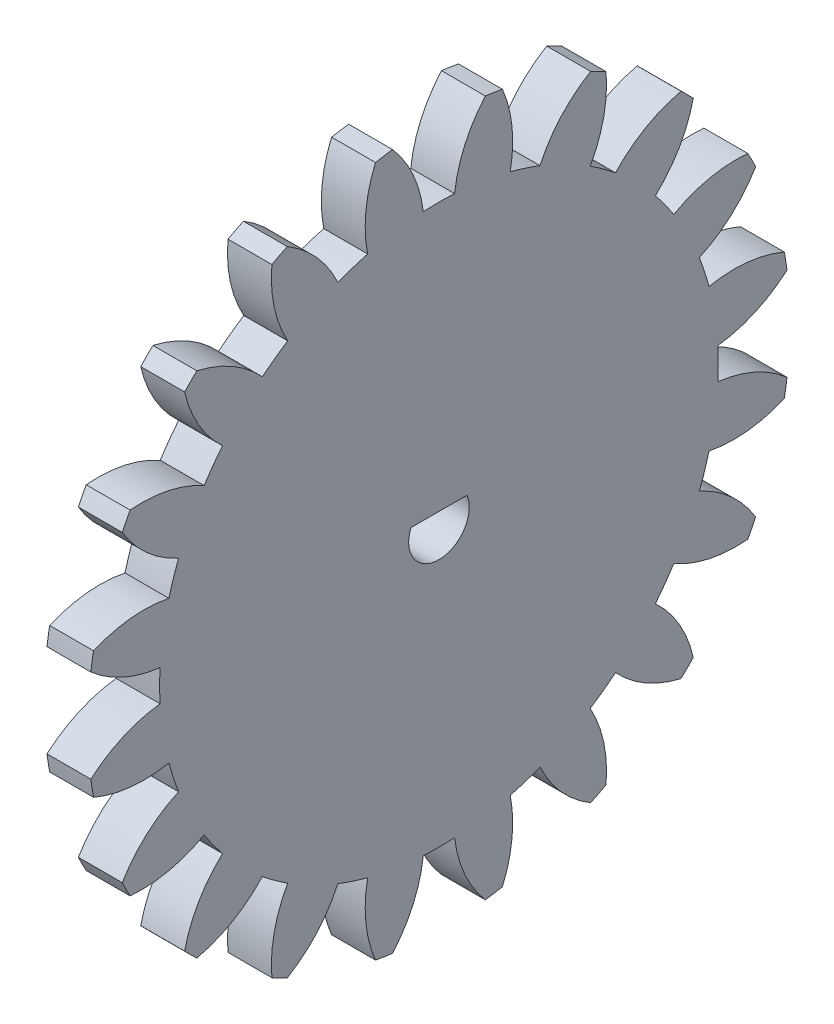
from build123d import *

# Parameters (mm, degrees)
BASPROSKE_W           = 5.5
BASPROSKE_H           = 44
TOOTHCUT_DEPTH        = 63.467991804
TEETHCUTS_COUNT       = 20
TEETHCUTS_ANGLE       = 342
BORSKE_R              = 0.5
BORE_DEPTH            = 50.0000508
CORTAR_EXTRUIR1_DEPTH = 5.5


with BuildPart() as part:
    # BasProSke → Base-Revolve (revolve)
    with BuildSketch(Plane(origin=(0, 0, 0), x_dir=(1, 0, 0), z_dir=(0, 1, 0)), mode=Mode.PRIVATE) as base_revolve_sk:
        with Locations((2.75, 22)):
            Rectangle(BASPROSKE_W, BASPROSKE_H)
    revolve(base_revolve_sk.sketch.rotate(Axis((-10, 0, 0), (1, 0, 0)), 180), axis=Axis((-10, 0, 0), (1, 0, 0)))

    # TooCutSke → ToothCut (cut, through all)
    with BuildSketch(Plane(origin=(0, 0, 0), x_dir=(0, 0, -1), z_dir=(1, 0, 0))):
        with BuildLine():
            ThreePointArc((1.961730392, 34.943978235), (0, 34.999), (-1.961730392, 34.943978235))
            ThreePointArc((-1.961730392, 34.943978235), (-3.235659864, 39.585086827), (-5.832115241, 43.637395396))
            ThreePointArc((-5.832115241, 43.637395396), (0, 44.0254), (5.832115241, 43.637395396))
            ThreePointArc((5.832115241, 43.637395396), (3.235659864, 39.585086827), (1.961730392, 34.943978235))
        make_face()
    toothcut = extrude(amount=TOOTHCUT_DEPTH, mode=Mode.SUBTRACT)

    # TeethCuts: ToothCut ×20 about axis
    teethcuts_axis = Axis((-10, 0, 0), (1, 0, 0))
    for i in range(1, TEETHCUTS_COUNT):
        add(toothcut.rotate(teethcuts_axis, i * TEETHCUTS_ANGLE / (TEETHCUTS_COUNT - 1)), mode=Mode.SUBTRACT)

    # BorSke → Bore (cut, symmetric)
    with BuildSketch(Plane(origin=(0, 0, 0), x_dir=(0, 0, -1), z_dir=(1, 0, 0))):
        with Locations(Location((0, 0, 0), (0, 0, 180))):
            Circle(BORSKE_R)
    extrude(amount=BORE_DEPTH, both=True, mode=Mode.SUBTRACT)

    # Croquis1 → Cortar-Extruir1 (cut)
    with BuildSketch(Plane(origin=(5.5, 0, 0), x_dir=(0, 0, -1), z_dir=(1, 0, 0))):
        with BuildLine():
            Line((-3.51323213, 1.435), (3.51323213, 1.435))
            ThreePointArc((3.51323213, 1.435), (0, -3.795), (-3.51323213, 1.435))
        make_face()
    extrude(amount=-CORTAR_EXTRUIR1_DEPTH, mode=Mode.SUBTRACT)


solid = part.part
